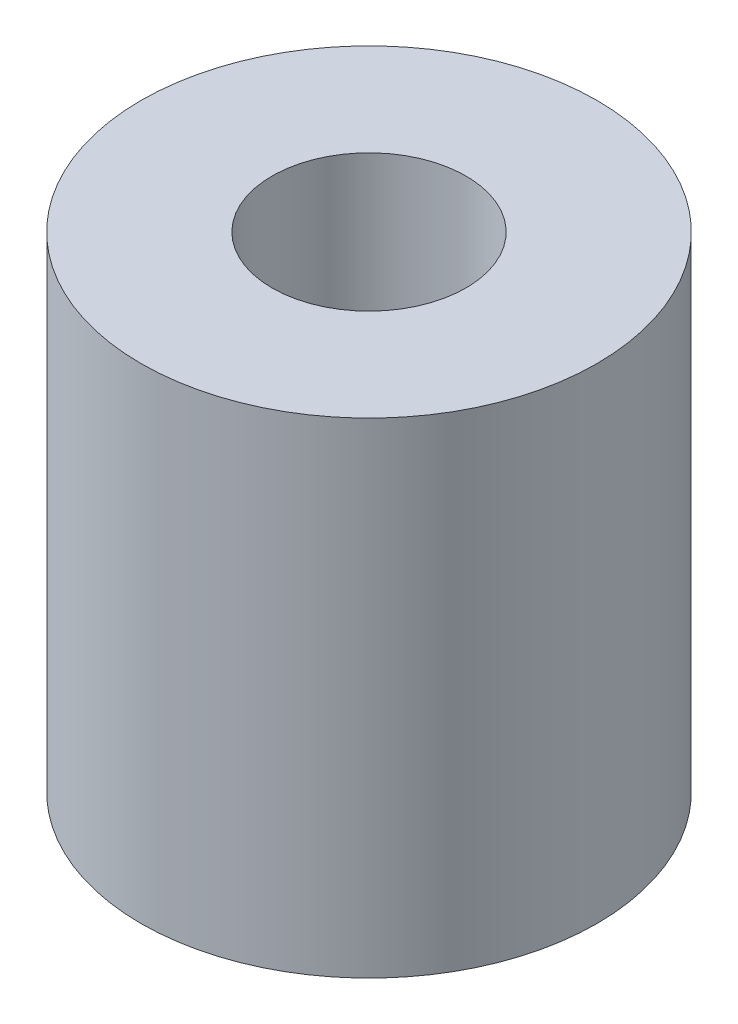
from build123d import *

# Parameters (mm, degrees)
CROQUIS1_R              = 11.75
CROQUIS1_R_2            = 5
SALIENTE_EXTRUIR1_DEPTH = 25


with BuildPart() as part:
    # Croquis1 → Saliente-Extruir1 (new body)
    with BuildSketch(Plane(origin=(0, 0, 0), x_dir=(1, 0, 0), z_dir=(0, 1, 0))):
        with Locations(Location((0, 0, 0), (0, 0, 270))):
            Circle(CROQUIS1_R)
        with Locations(Location((0, 0, 0), (0, 0, 270))):
            Circle(CROQUIS1_R_2, mode=Mode.SUBTRACT)
    extrude(amount=SALIENTE_EXTRUIR1_DEPTH)


solid = part.part
